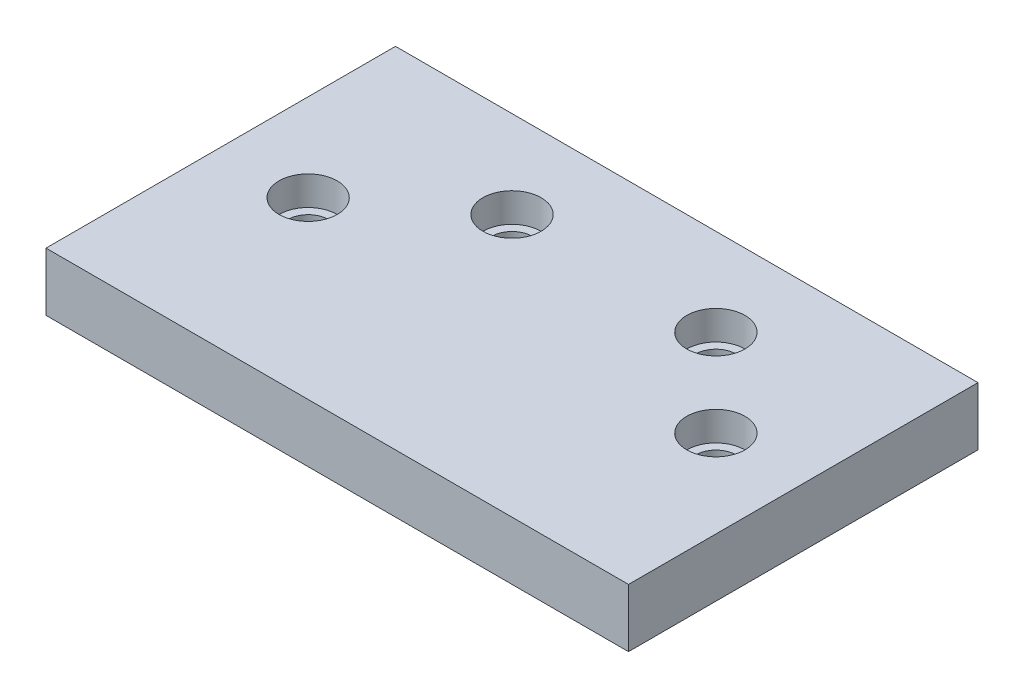
from build123d import *

# Parameters (mm, degrees)
SKETCH_1_W          = 20
SKETCH_1_H          = 12
SKETCH_1_R          = 0.7
EXTRUDE_1_DEPTH     = 2
CUT_EXTRUDE_START   = 2
SKETCH_1_3_R        = 1
CUT_EXTRUDE_1_DEPTH = 1


with BuildPart() as part:
    # 草图1 → 凸台-拉伸1 (new body)
    with BuildSketch(Plane(origin=(0, 0, 0), x_dir=(1, 0, 0), z_dir=(0, 1, 0))):
        with Locations((10, -6)):
            Rectangle(SKETCH_1_W, SKETCH_1_H)
        with Locations(Location((3, -6, 0), (0, 0, 270))):
            Circle(SKETCH_1_R, mode=Mode.SUBTRACT)
        with Locations(Location((7, -3, 0), (0, 0, 270))):
            Circle(SKETCH_1_R, mode=Mode.SUBTRACT)
        with Locations(Location((14, -3, 0), (0, 0, 270))):
            Circle(SKETCH_1_R, mode=Mode.SUBTRACT)
        with Locations(Location((17, -6, 0), (0, 0, 270))):
            Circle(SKETCH_1_R, mode=Mode.SUBTRACT)
    extrude(amount=EXTRUDE_1_DEPTH)

    # 草图1<3> → 切除-拉伸1 (cut)
    with BuildSketch(Plane(origin=(0, 0, 0), x_dir=(1, 0, 0), z_dir=(0, 1, 0)).offset(CUT_EXTRUDE_START)):
        with Locations(Location((3, -6, 0), (0, 0, 270))):
            Circle(SKETCH_1_3_R)
        with Locations(Location((7, -3, 0), (0, 0, 270))):
            Circle(SKETCH_1_3_R)
        with Locations(Location((14, -3, 0), (0, 0, 270))):
            Circle(SKETCH_1_3_R)
        with Locations(Location((17, -6, 0), (0, 0, 270))):
            Circle(SKETCH_1_3_R)
    extrude(amount=-CUT_EXTRUDE_1_DEPTH, mode=Mode.SUBTRACT)


solid = part.part
